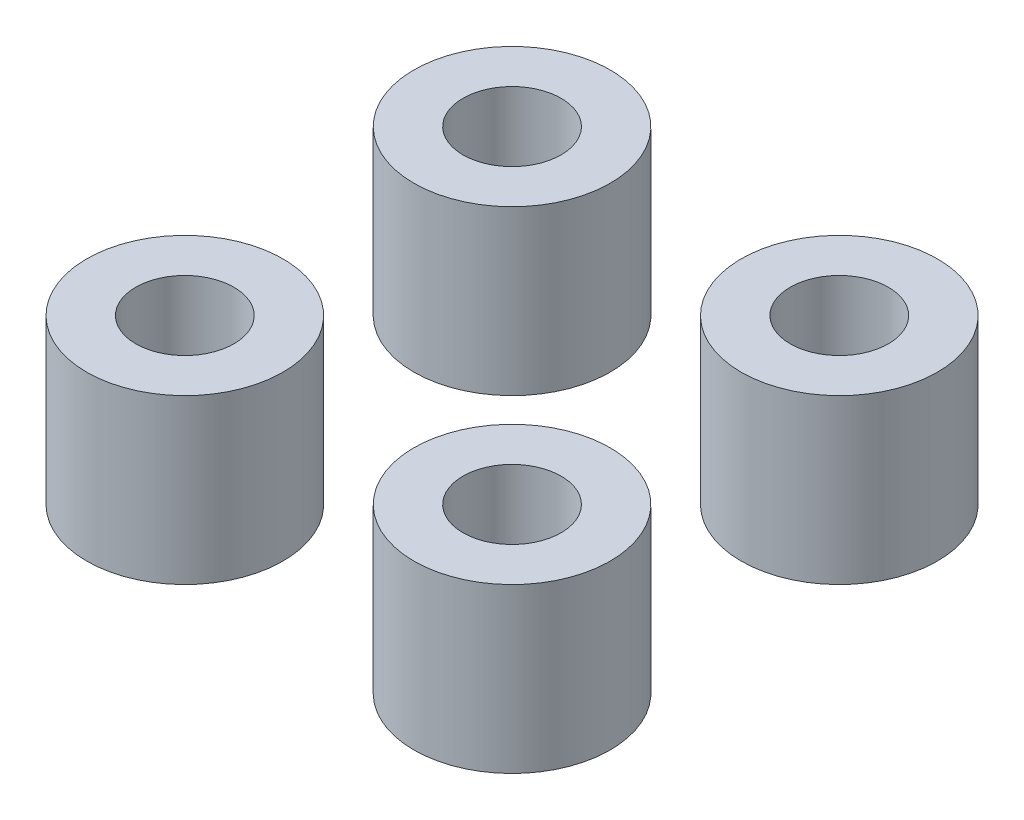
from build123d import *

# Parameters (mm, degrees)
SKETCH_1_R        = 6
SKETCH_1_R_2      = 3
EXTRUDE_1_DEPTH   = 10
EXTRUDE_1_2_DEPTH = 10
EXTRUDE_1_3_DEPTH = 10
EXTRUDE_1_4_DEPTH = 10


with BuildPart() as part:
    # Эскиз1 → Бобышка-Вытянуть1 (new body)
    with BuildSketch(Plane(origin=(0, 0, 0), x_dir=(1, 0, 0), z_dir=(0, 1, 0))):
        with Locations(Location((0, 0, 0), (0, 0, 270))):
            Circle(SKETCH_1_R)
        with Locations(Location((0, 0, 0), (0, 0, 270))):
            Circle(SKETCH_1_R_2, mode=Mode.SUBTRACT)
    extrude(amount=EXTRUDE_1_DEPTH)


with BuildPart() as body_2:
    # Эскиз1 → Extrude 1 2 (new body)
    with BuildSketch(Plane(origin=(0, 0, 0), x_dir=(1, 0, 0), z_dir=(0, 1, 0))):
        with Locations(Location((0, 20, 0), (0, 0, 270))):
            Circle(SKETCH_1_R)
        with Locations(Location((0, 20, 0), (0, 0, 270))):
            Circle(SKETCH_1_R_2, mode=Mode.SUBTRACT)
    extrude(amount=EXTRUDE_1_2_DEPTH)


with BuildPart() as body_3:
    # Эскиз1 → Extrude 1 3 (new body)
    with BuildSketch(Plane(origin=(0, 0, 0), x_dir=(1, 0, 0), z_dir=(0, 1, 0))):
        with Locations(Location((20, 20, 0), (0, 0, 270))):
            Circle(SKETCH_1_R)
        with Locations(Location((20, 20, 0), (0, 0, 270))):
            Circle(SKETCH_1_R_2, mode=Mode.SUBTRACT)
    extrude(amount=EXTRUDE_1_3_DEPTH)


with BuildPart() as body_4:
    # Эскиз1 → Extrude 1 4 (new body)
    with BuildSketch(Plane(origin=(0, 0, 0), x_dir=(1, 0, 0), z_dir=(0, 1, 0))):
        with Locations(Location((20, 0, 0), (0, 0, 270))):
            Circle(SKETCH_1_R)
        with Locations(Location((20, 0, 0), (0, 0, 270))):
            Circle(SKETCH_1_R_2, mode=Mode.SUBTRACT)
    extrude(amount=EXTRUDE_1_4_DEPTH)


solid = Compound([part.part, body_2.part, body_3.part, body_4.part])
